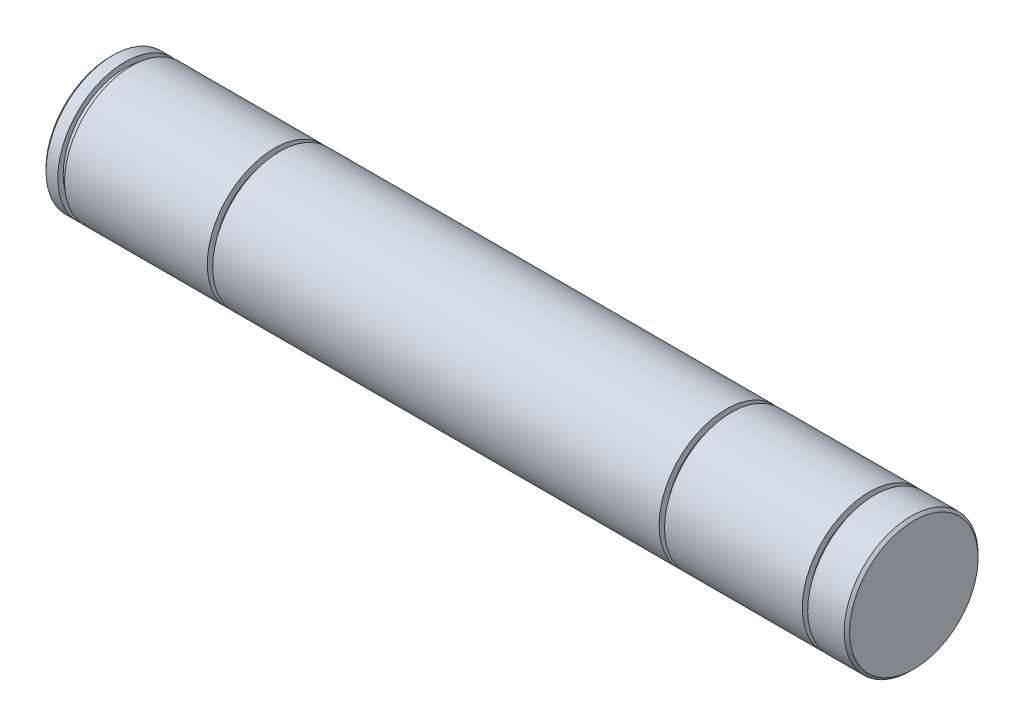
from build123d import *


with BuildPart() as part:
    # Esboço1 → Revolução1 (revolve)
    with BuildSketch(Plane.XY, mode=Mode.PRIVATE) as revolu_o1_sk:
        Polygon((0, 0), (300, 0), (300, 24), (299, 25), (285.363331024, 25), (285.363331024, 22.5), (283.363331024, 22.5), (283.363331024, 25), (231.910129711, 25), (231.910129711, 22.5), (229.910129711, 22.5), (229.910129711, 25), (220, 25), (63.219900676, 25), (63.219900676, 22.5), (61.219900676, 22.5), (61.219900676, 25), (7.914643103, 25), (7.914643103, 23), (5.414643103, 23), (5.414643103, 25), (1, 25), (0, 24), align=None)
    revolve(revolu_o1_sk.sketch.rotate(Axis((0, 0, 0), (1, 0, 0)), 90), axis=Axis((0, 0, 0), (1, 0, 0)))


solid = part.part
